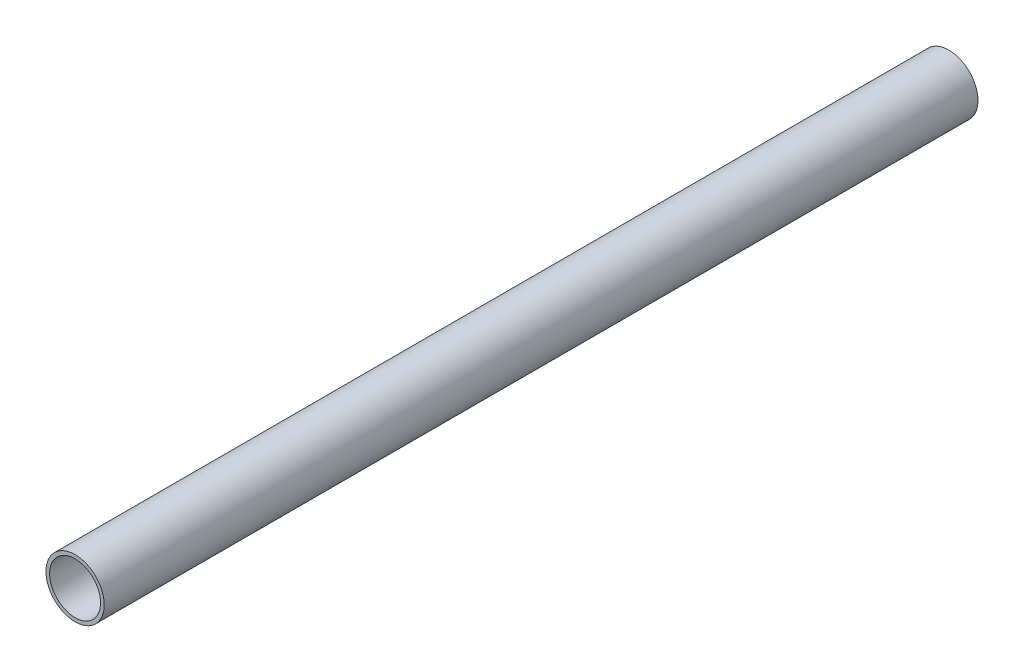
from build123d import *

# Parameters (mm, degrees)
SKETCH1_R           = 8
SKETCH1_R_2         = 7
BOSS_EXTRUDE1_DEPTH = 240


with BuildPart() as part:
    # Sketch1 → Boss-Extrude1 (new body)
    with BuildSketch(Plane.XY):
        Circle(SKETCH1_R)
        Circle(SKETCH1_R_2, mode=Mode.SUBTRACT)
    extrude(amount=BOSS_EXTRUDE1_DEPTH)


solid = part.part
